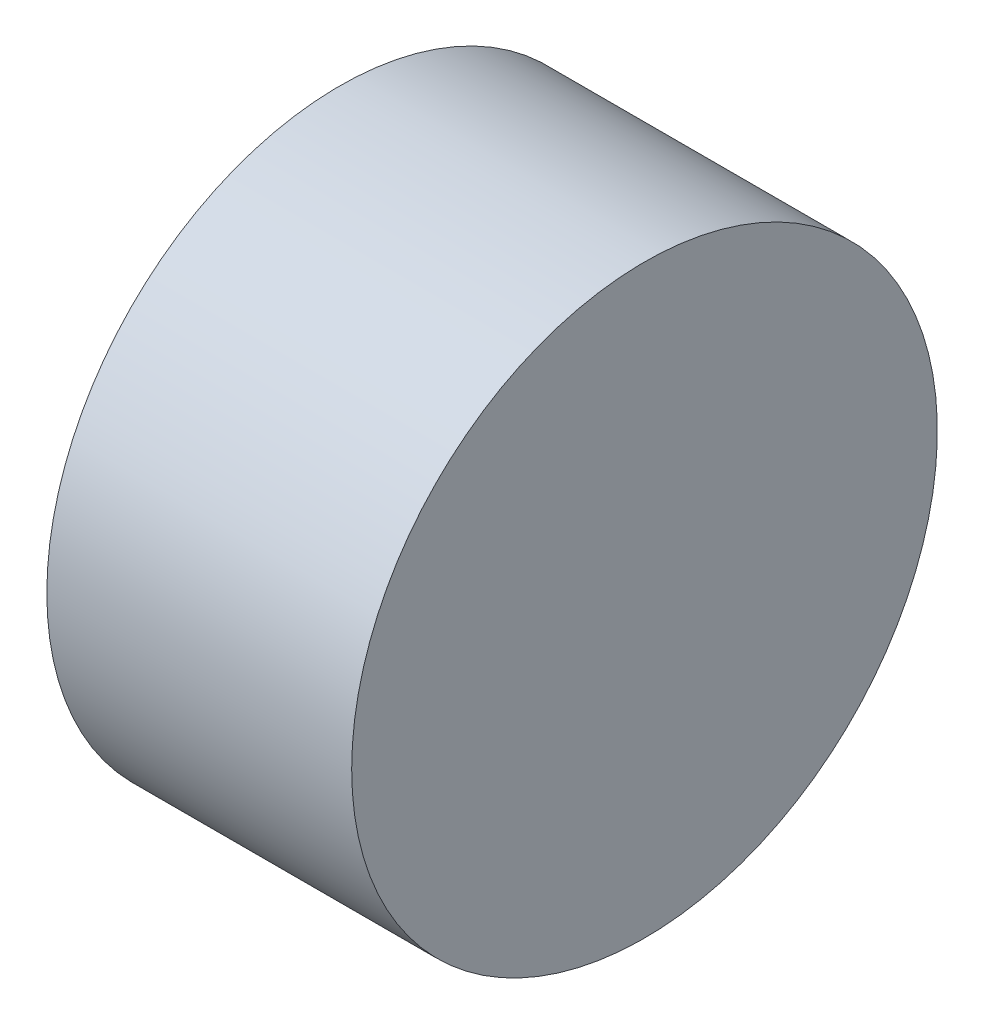
from build123d import *

# Parameters (mm, degrees)
CUT_EXTRUDE_1_DEPTH = 3
SKETCH_4_R          = 0.75
CUT_EXTRUDE_2_DEPTH = 3
SKETCH_6_R          = 0.65
CUT_EXTRUDE_3_DEPTH = 3


with BuildPart() as part:
    # 草图1 → 旋转1 (revolve)
    with BuildSketch(Plane(origin=(0, 0, 0), x_dir=(1, 0, 0), z_dir=(0, 1, 0)), mode=Mode.PRIVATE) as revolve_1_sk:
        Polygon((0, 0), (-16.7, 0), (-16.7, 3), (-12.7, 3), (-12.7, 12.2), (0, 12.2), align=None)
    revolve(revolve_1_sk.sketch.rotate(Axis((-159.613189405, 0, 0), (1, 0, 0)), 180), axis=Axis((-159.613189405, 0, 0), (1, 0, 0)))

    # 草图3 → 切除-拉伸1 (cut)
    with BuildSketch(Plane.ZY.offset(12.7)):
        with BuildLine():
            ThreePointArc((-8.667998766, 2.421940832), (-8.99040601, 0.415451281), (-8.854419452, -1.612220883))
            ThreePointArc((-8.854419452, -1.612220883), (-9.764043418, -2.198869939), (-10.822068219, -1.97049219))
            ThreePointArc((-10.822068219, -1.97049219), (-10.988274013, 0.507773788), (-10.594220714, 2.960149905))
            ThreePointArc((-10.594220714, 2.960149905), (-9.519642991, 3.089978996), (-8.667998766, 2.421940832))
        make_face()
        with BuildLine():
            ThreePointArc((6.43146167, 6.295736716), (4.854994369, 7.578194355), (3.030985485, 8.474262622))
            ThreePointArc((3.030985485, 8.474262622), (2.977744482, 9.555344613), (3.704537815, 10.357432094))
            ThreePointArc((3.704537815, 10.357432094), (5.933882006, 9.262237545), (7.860675374, 7.694789319))
            ThreePointArc((7.860675374, 7.694789319), (7.435821803, 6.699263167), (6.43146167, 6.295736716))
        make_face()
        with BuildLine():
            ThreePointArc((2.236537096, -8.717677547), (4.135411642, -7.993645636), (5.823433967, -6.862041739))
            ThreePointArc((5.823433967, -6.862041739), (6.786298936, -7.356474674), (7.117530404, -8.386939904))
            ThreePointArc((7.117530404, -8.386939904), (5.054392007, -9.770011333), (2.73354534, -10.654939224))
            ThreePointArc((2.73354534, -10.654939224), (2.083821188, -9.789242163), (2.236537096, -8.717677547))
        make_face()
    extrude(amount=-CUT_EXTRUDE_1_DEPTH, mode=Mode.SUBTRACT)

    # 草图4 → 切除-拉伸2 (cut)
    with BuildSketch(Plane.ZY.offset(12.7)):
        with Locations((-2.818506641, 5.448101727)):
            Circle(SKETCH_4_R)
        with Locations((-4.135411642, 7.993645636)):
            Circle(SKETCH_4_R)
        with Locations((8.99040601, -0.415451281)):
            Circle(SKETCH_4_R)
        with Locations((6.127447818, -0.283152512)):
            Circle(SKETCH_4_R)
        with Locations((-4.854994369, -7.578194355)):
            Circle(SKETCH_4_R)
        with Locations((-3.308941178, -5.164949215)):
            Circle(SKETCH_4_R)
    extrude(amount=-CUT_EXTRUDE_2_DEPTH, mode=Mode.SUBTRACT)

    # 草图6 → 切除-拉伸3 (cut)
    with BuildSketch(Plane.ZY.offset(12.7)):
        with Locations((0, 5.083503848)):
            Circle(SKETCH_6_R)
        with Locations((0, -5.083503848)):
            Circle(SKETCH_6_R)
    extrude(amount=-CUT_EXTRUDE_3_DEPTH, mode=Mode.SUBTRACT)


solid = part.part
